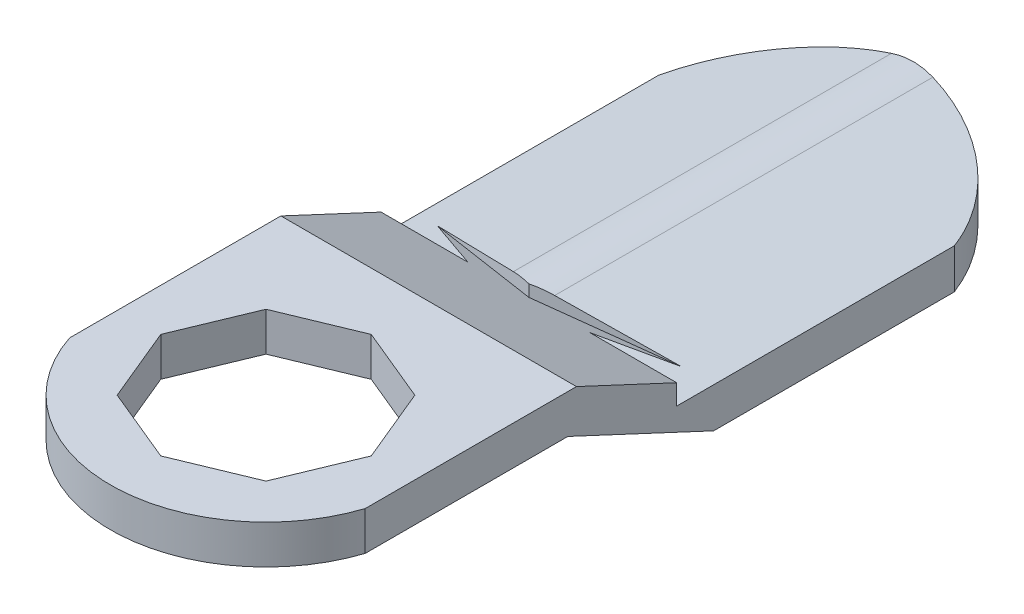
from build123d import *

# Parameters (mm, degrees)
EXTRUDE_1_DEPTH          = 2
EXTRUDE_START            = -8
EXTRUDE_2_DEPTH          = 8
CUT_EXTRUDE_1_DEPTH      = 23.468559083
CUT_EXTRUDE_1_DEPTH_BACK = 23.468559083
EXTRUDE_3_DEPTH          = 5.5
CUT_EXTRUDE_START        = 1.7
SKETCH_6_OUTSIDE_W       = 26.07
SKETCH_6_OUTSIDE_H       = 16.37
CUT_EXTRUDE_2_DEPTH      = 19.782223


with BuildPart() as part:
    # 草图1 → 凸台-拉伸1 (new body)
    with BuildSketch(Plane(origin=(0, 0, 0), x_dir=(1, 0, 0), z_dir=(0, 1, 0))):
        with BuildLine():
            Line((-7.6, -2.497999199), (-7.6, 7.9206403))
            ThreePointArc((-7.6, 7.9206403), (0, 9.5), (7.6, 7.9206403))
            Line((7.6, 7.9206403), (7.6, -2.497999199))
            ThreePointArc((7.6, -2.497999199), (0, -8), (-7.6, -2.497999199))
        make_face()
        Polygon((0, 5.411961001), (-3.826834324, 3.826834324), (-5.411961001, 0), (-3.826834324, -3.826834324), (0, -5.411961001), (3.826834324, -3.826834324), (5.411961001, 0), (3.826834324, 3.826834324), align=None, mode=Mode.SUBTRACT)
    extrude(amount=EXTRUDE_1_DEPTH)

    # 草图3 → 凸台-拉伸2 (add)
    with BuildSketch(Plane(origin=(0, 2, 0), x_dir=(1, 0, 0), z_dir=(0, 1, 0)).offset(EXTRUDE_START)):
        with BuildLine():
            Line((-7.6, 7.9206403), (-7.6, 15.4206403))
            Line((-7.6, 15.4206403), (0, 13.517776718))
            Line((0, 13.517776718), (7.6, 15.4206403))
            Line((7.6, 15.4206403), (7.6, 7.9206403))
            ThreePointArc((7.6, 7.9206403), (0, 9.5), (-7.6, 7.9206403))
        make_face()
    extrude(amount=EXTRUDE_2_DEPTH)

    # 草图4 → 切除-拉伸1 (cut, two sides: drawn at the far end of the back side and taken through both)
    with BuildSketch(Plane(origin=(7.6, 0, 0), x_dir=(0, 0, -1), z_dir=(1, 0, 0)).offset(-CUT_EXTRUDE_1_DEPTH_BACK)):
        Polygon((15.4206403, 2), (8.364338974, 2), (15.4206403, -1.292940619), align=None)
        Polygon((15.4206403, -6), (15.4206403, -3.5), (7.9206403, 0), (7.9206403, -6), align=None)
    extrude(amount=CUT_EXTRUDE_1_DEPTH + CUT_EXTRUDE_1_DEPTH_BACK, mode=Mode.SUBTRACT)

    # 草图5 → 凸台-拉伸3 (add)
    with BuildSketch(Plane(origin=(0, 2, 0), x_dir=(1, 0, 0), z_dir=(0, 1, 0))):
        with BuildLine():
            Line((-7.6, 15.4206403), (-7.6, 27.797999199))
            ThreePointArc((-7.6, 27.797999199), (0, 33.3), (7.6, 27.797999199))
            Line((7.6, 27.797999199), (7.6, 15.4206403))
            Line((7.6, 15.4206403), (0, 13.517776718))
            Line((0, 13.517776718), (-7.6, 15.4206403))
        make_face()
    extrude(amount=-EXTRUDE_3_DEPTH)

    # 草图6 outside → 切除-拉伸2 (cut)
    with BuildSketch(Plane.XY.offset(-35).offset(CUT_EXTRUDE_START)):
        with Locations((0, -0.75)):
            Rectangle(SKETCH_6_OUTSIDE_W, SKETCH_6_OUTSIDE_H)
        with BuildLine():
            Line((7.6, -1.446364095), (1.062655153, 0.077764377))
            ThreePointArc((1.062655153, 0.077764377), (0, 0.2), (-1.062655153, 0.077764377))
            Line((-1.062655153, 0.077764377), (-7.6, -1.446364095))
            Line((-7.6, -1.446364095), (-7.6, -3.5))
            Line((-7.6, -3.5), (-0.608549693, -1.870000556))
            ThreePointArc((-0.608549693, -1.870000556), (0, -1.8), (0.608549693, -1.870000556))
            Line((0.608549693, -1.870000556), (7.6, -3.5))
            Line((7.6, -3.5), (7.6, -1.446364095))
        make_face(mode=Mode.SUBTRACT)
    extrude(amount=CUT_EXTRUDE_2_DEPTH, mode=Mode.SUBTRACT)


solid = part.part
